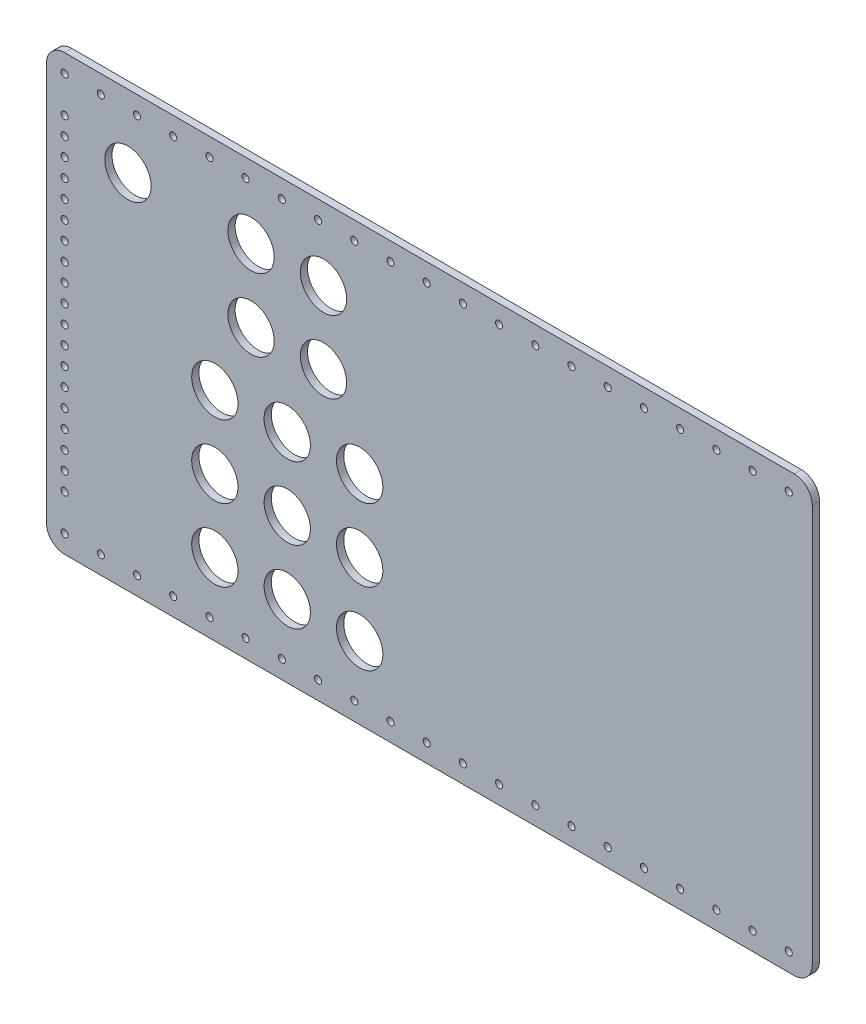
from build123d import *

# Parameters (mm, degrees)
SKETCH1_W           = 381
SKETCH1_H           = 304.8
BOSS_EXTRUDE1_DEPTH = 5.08
SKETCH3_R           = 16.25
SKETCH3_R_2         = 16.256
CUT_EXTRUDE2_DEPTH  = 488.944511599
SKETCH4_W           = 133.35
SKETCH4_H           = 304.8
SKETCH4_W_2         = 38.1
BOSS_EXTRUDE2_DEPTH = 5.08
SKETCH5_R           = 2.4892
CUT_EXTRUDE3_DEPTH  = 588.01070595
FILLET1_R           = 12.7


with BuildPart() as part:
    # Sketch1 → Boss-Extrude1 (new body)
    with BuildSketch(Plane.XY):
        with Locations((190.5, 152.4)):
            Rectangle(SKETCH1_W, SKETCH1_H)
    extrude(amount=BOSS_EXTRUDE1_DEPTH)

    # Sketch3 → Cut-Extrude2 (cut, through all)
    with BuildSketch(Plane(origin=(0, 0, 0), x_dir=(-1, 0, 0), z_dir=(0, 0, -1))):
        with Locations((-158.75, 254)):
            Circle(SKETCH3_R)
        with Locations((-107.95, 254)):
            Circle(SKETCH3_R)
        with Locations((-21.59, 254)):
            Circle(SKETCH3_R_2)
        with Locations((-158.75, 203.2)):
            Circle(SKETCH3_R)
        with Locations((-107.95, 203.2)):
            Circle(SKETCH3_R)
        with Locations((-184.15, 152.4)):
            Circle(SKETCH3_R)
        with Locations((-133.35, 152.4)):
            Circle(SKETCH3_R)
        with Locations((-82.55, 152.4)):
            Circle(SKETCH3_R)
        with Locations((-184.15, 101.6)):
            Circle(SKETCH3_R)
        with Locations((-133.35, 101.6)):
            Circle(SKETCH3_R)
        with Locations((-82.55, 101.6)):
            Circle(SKETCH3_R)
        with Locations((-184.15, 50.8)):
            Circle(SKETCH3_R)
        with Locations((-133.35, 50.8)):
            Circle(SKETCH3_R)
        with Locations((-82.55, 50.8)):
            Circle(SKETCH3_R)
    extrude(amount=-CUT_EXTRUDE2_DEPTH, mode=Mode.SUBTRACT)

    # Sketch4 → Boss-Extrude2 (add, through all)
    with BuildSketch(Plane(origin=(0, 0, 0), x_dir=(-1, 0, 0), z_dir=(0, 0, -1))):
        with Locations((-434.975, 152.4)):
            Rectangle(SKETCH4_W, SKETCH4_H)
        with Locations((16.487542192, 152.4)):
            Rectangle(SKETCH4_W_2, SKETCH4_H)
    extrude(amount=-BOSS_EXTRUDE2_DEPTH)

    # Sketch5 → Cut-Extrude3 (cut, through all)
    with BuildSketch(Plane(origin=(0, 0, 0), x_dir=(-1, 0, 0), z_dir=(0, 0, -1))):
        with Locations((22.837542192, 292.1)):
            Circle(SKETCH5_R)
        with Locations((22.837542192, 266.7)):
            Circle(SKETCH5_R)
        with Locations((22.837542192, 241.3)):
            Circle(SKETCH5_R)
        with Locations((22.837542192, 215.9)):
            Circle(SKETCH5_R)
        with Locations((22.837542192, 190.5)):
            Circle(SKETCH5_R)
        with Locations((22.837542192, 165.1)):
            Circle(SKETCH5_R)
        with Locations((22.837542192, 139.7)):
            Circle(SKETCH5_R)
        with Locations((22.837542192, 114.3)):
            Circle(SKETCH5_R)
        with Locations((22.837542192, 88.9)):
            Circle(SKETCH5_R)
        with Locations((22.837542192, 63.5)):
            Circle(SKETCH5_R)
        with Locations((22.837542192, 38.1)):
            Circle(SKETCH5_R)
        with Locations((22.837542192, 12.7)):
            Circle(SKETCH5_R)
        with Locations((22.837542192, 254)):
            Circle(SKETCH5_R)
        with Locations((22.837542192, 228.6)):
            Circle(SKETCH5_R)
        with Locations((22.837542192, 203.2)):
            Circle(SKETCH5_R)
        with Locations((22.837542192, 177.8)):
            Circle(SKETCH5_R)
        with Locations((22.837542192, 152.4)):
            Circle(SKETCH5_R)
        with Locations((22.837542192, 127)):
            Circle(SKETCH5_R)
        with Locations((22.837542192, 101.6)):
            Circle(SKETCH5_R)
        with Locations((22.837542192, 76.2)):
            Circle(SKETCH5_R)
        with Locations((22.837542192, 50.8)):
            Circle(SKETCH5_R)
        with Locations((-2.562457808, 292.1)):
            Circle(SKETCH5_R)
        with Locations((-27.962457808, 292.1)):
            Circle(SKETCH5_R)
        with Locations((-53.362457808, 292.1)):
            Circle(SKETCH5_R)
        with Locations((-78.762457808, 292.1)):
            Circle(SKETCH5_R)
        with Locations((-104.162457808, 292.1)):
            Circle(SKETCH5_R)
        with Locations((-129.562457808, 292.1)):
            Circle(SKETCH5_R)
        with Locations((-154.962457808, 292.1)):
            Circle(SKETCH5_R)
        with Locations((-180.362457808, 292.1)):
            Circle(SKETCH5_R)
        with Locations((-205.762457808, 292.1)):
            Circle(SKETCH5_R)
        with Locations((-231.162457808, 292.1)):
            Circle(SKETCH5_R)
        with Locations((-256.562457808, 292.1)):
            Circle(SKETCH5_R)
        with Locations((-281.962457808, 292.1)):
            Circle(SKETCH5_R)
        with Locations((-307.362457808, 292.1)):
            Circle(SKETCH5_R)
        with Locations((-332.762457808, 292.1)):
            Circle(SKETCH5_R)
        with Locations((-358.162457808, 292.1)):
            Circle(SKETCH5_R)
        with Locations((-383.562457808, 292.1)):
            Circle(SKETCH5_R)
        with Locations((-408.962457808, 292.1)):
            Circle(SKETCH5_R)
        with Locations((-434.362457808, 292.1)):
            Circle(SKETCH5_R)
        with Locations((-459.762457808, 292.1)):
            Circle(SKETCH5_R)
        with Locations((-485.162457808, 292.1)):
            Circle(SKETCH5_R)
        with Locations((-2.562457808, 12.7)):
            Circle(SKETCH5_R)
        with Locations((-27.962457808, 12.7)):
            Circle(SKETCH5_R)
        with Locations((-53.362457808, 12.7)):
            Circle(SKETCH5_R)
        with Locations((-78.762457808, 12.7)):
            Circle(SKETCH5_R)
        with Locations((-104.162457808, 12.7)):
            Circle(SKETCH5_R)
        with Locations((-129.562457808, 12.7)):
            Circle(SKETCH5_R)
        with Locations((-154.962457808, 12.7)):
            Circle(SKETCH5_R)
        with Locations((-180.362457808, 12.7)):
            Circle(SKETCH5_R)
        with Locations((-205.762457808, 12.7)):
            Circle(SKETCH5_R)
        with Locations((-231.162457808, 12.7)):
            Circle(SKETCH5_R)
        with Locations((-256.562457808, 12.7)):
            Circle(SKETCH5_R)
        with Locations((-281.962457808, 12.7)):
            Circle(SKETCH5_R)
        with Locations((-307.362457808, 12.7)):
            Circle(SKETCH5_R)
        with Locations((-332.762457808, 12.7)):
            Circle(SKETCH5_R)
        with Locations((-358.162457808, 12.7)):
            Circle(SKETCH5_R)
        with Locations((-383.562457808, 12.7)):
            Circle(SKETCH5_R)
        with Locations((-408.962457808, 12.7)):
            Circle(SKETCH5_R)
        with Locations((-434.362457808, 12.7)):
            Circle(SKETCH5_R)
        with Locations((-459.762457808, 12.7)):
            Circle(SKETCH5_R)
        with Locations((-485.162457808, 12.7)):
            Circle(SKETCH5_R)
    extrude(amount=-CUT_EXTRUDE3_DEPTH, mode=Mode.SUBTRACT)

    # Fillet1
    fillet1_edges = [part.edges().sort_by_distance(p)[0] for p in [
        (-35.537542192, 0, 2.54),
        (-35.537542192, 304.8, 2.54),
        (501.65, 304.8, 2.54),
        (501.65, 0, 2.54),
    ]]
    fillet(fillet1_edges, radius=FILLET1_R)


solid = part.part
